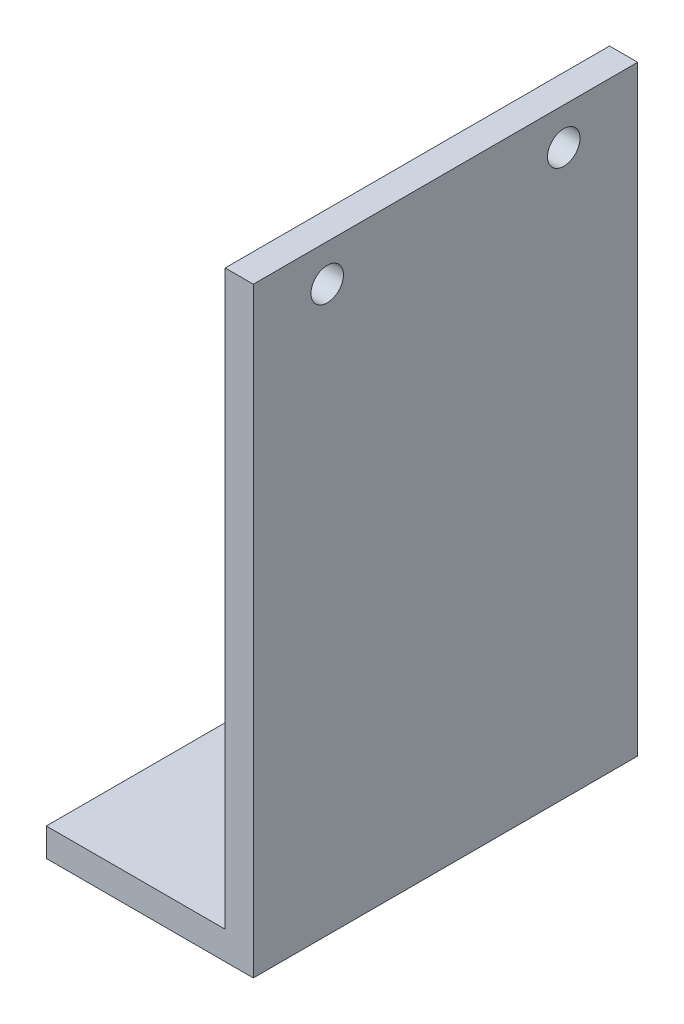
from build123d import *

# Parameters (mm, degrees)
BOSS_EXTRUDE1_DEPTH = 65
SKETCH2_R           = 2.75
CUT_EXTRUDE1_DEPTH  = 10


with BuildPart() as part:
    # Sketch1 → Boss-Extrude1 (new body)
    with BuildSketch(Plane.XY):
        Polygon((-77.4, 19.05), (-42.4, 19.05), (-42.4, 120.65), (-47.1625, 120.65), (-47.1625, 23.8125), (-77.4, 23.8125), align=None)
    extrude(amount=-BOSS_EXTRUDE1_DEPTH)

    # Sketch2 → Cut-Extrude1 (cut)
    with BuildSketch(Plane.ZY.offset(47.1625)):
        with Locations((-12.5, 114.417723435)):
            Circle(SKETCH2_R)
        with Locations((-52.5, 114.417723435)):
            Circle(SKETCH2_R)
    extrude(amount=-CUT_EXTRUDE1_DEPTH, mode=Mode.SUBTRACT)


solid = part.part
